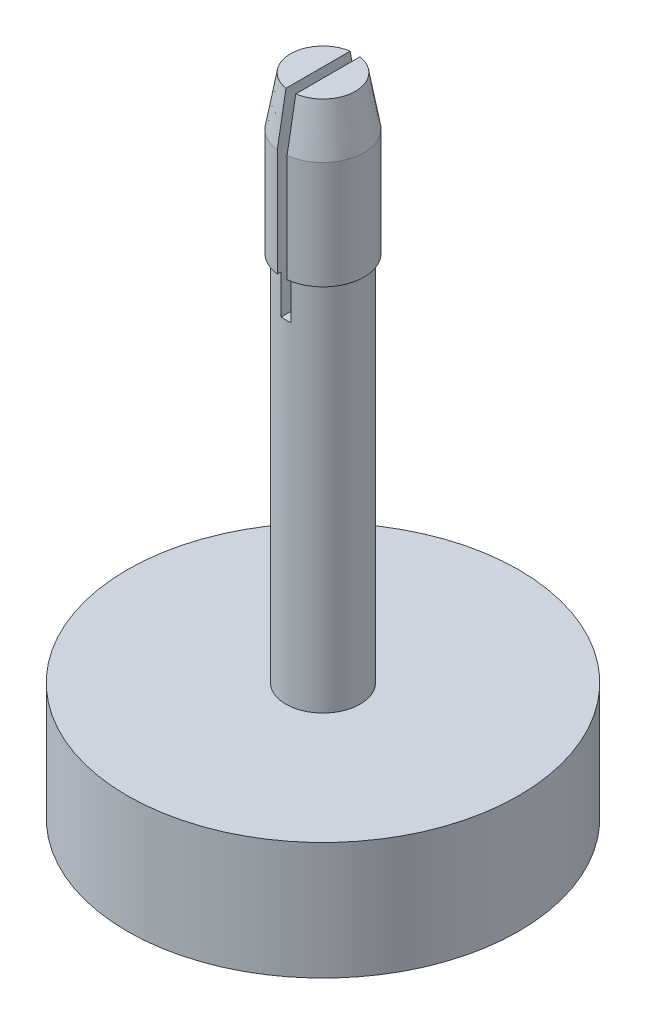
from build123d import *

# Parameters (mm, degrees)
ESQUISSE2_R             = 5
BOSS_EXTRU_1_DEPTH      = 3
ESQUISSE3_R             = 0.95
BOSS_EXTRU_2_DEPTH      = 9.5
ESQUISSE4_R             = 1.05
BOSS_EXTRU_3_DEPTH      = 4
CHANFREIN3_SIZE         = 1.25
CHANFREIN3_SIZE2        = 0.220408726
ESQUISSE5_W             = 0.25
ESQUISSE5_H             = 3
ENL_V_MAT_EXTRU_1_DEPTH = 5


with BuildPart() as part:
    # Esquisse2 → Boss.-Extru.1 (new body)
    with BuildSketch(Plane(origin=(0, 0, 0), x_dir=(1, 0, 0), z_dir=(0, 1, 0))):
        with Locations(Location((0, 0, 0), (0, 0, 270))):
            Circle(ESQUISSE2_R)
    extrude(amount=BOSS_EXTRU_1_DEPTH)

    # Esquisse3 → Boss.-Extru.2 (add)
    with BuildSketch(Plane(origin=(0, 3, 0), x_dir=(1, 0, 0), z_dir=(0, 1, 0))):
        with Locations(Location((0, 0, 0), (0, 0, 270))):
            Circle(ESQUISSE3_R)
    extrude(amount=BOSS_EXTRU_2_DEPTH)

    # Esquisse4 → Boss.-Extru.3 (add)
    with BuildSketch(Plane(origin=(0, 12.5, 0), x_dir=(1, 0, 0), z_dir=(0, 1, 0))):
        with Locations(Location((0, 0, 0), (0, 0, 270))):
            Circle(ESQUISSE4_R)
    extrude(amount=BOSS_EXTRU_3_DEPTH)

    # Chanfrein3
    chanfrein3_edges = [part.edges().sort_by_distance(p)[0] for p in [
        (0, 16.5, -1.05),
    ]]
    chanfrein3_side = [part.faces().sort_by_distance(p)[0] for p in [
        (0, 14.5, -1.05),
    ]]
    chamfer(chanfrein3_edges, length=CHANFREIN3_SIZE, length2=CHANFREIN3_SIZE2, reference=chanfrein3_side[0])

    # Esquisse5 → Enlèv. mat.-Extru.1 (cut)
    with BuildSketch(Plane(origin=(0, 16.5, 0), x_dir=(1, 0, 0), z_dir=(0, 1, 0))):
        Rectangle(ESQUISSE5_W, ESQUISSE5_H)
    extrude(amount=-ENL_V_MAT_EXTRU_1_DEPTH, mode=Mode.SUBTRACT)


solid = part.part
